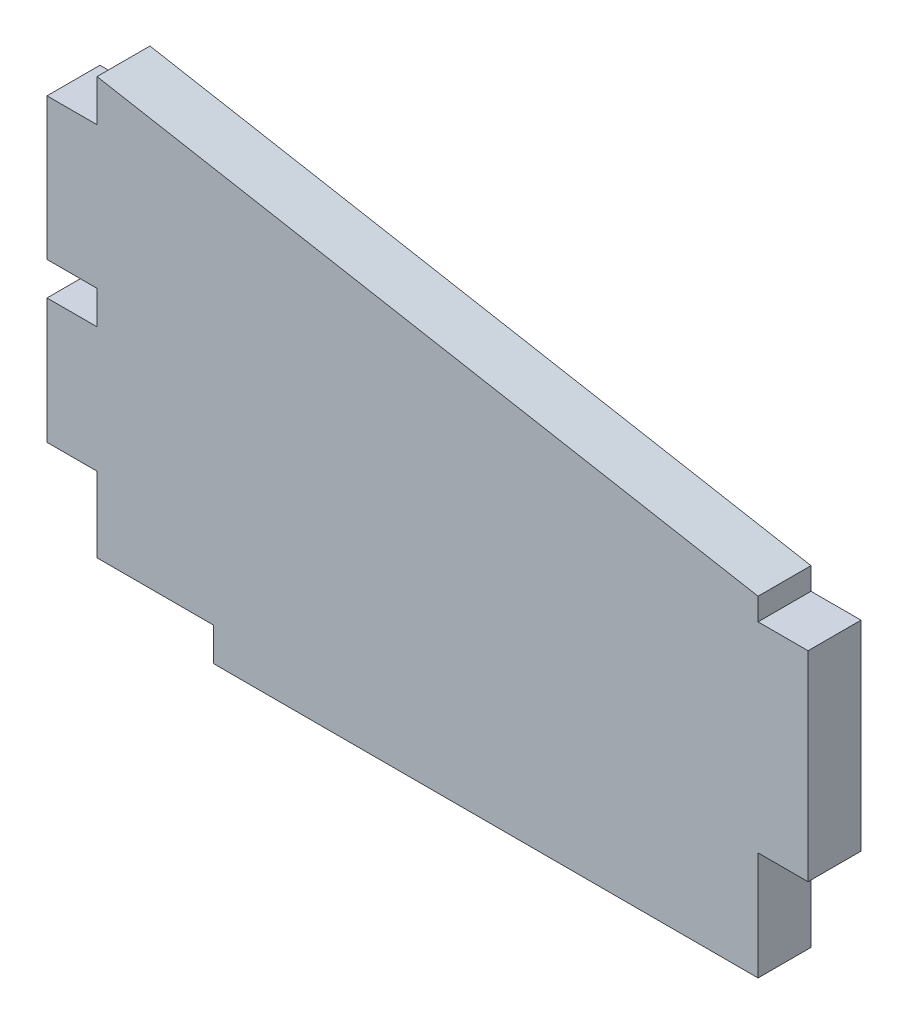
from build123d import *

# Parameters (mm, degrees)
SKETCH1_W               = 3
SKETCH1_H               = 12
SKETCH1_H_2             = 18
BOSS_EXTRUDE1_DEPTH     = 3.175
SKETCH2_W               = 32.65
SKETCH2_H               = 2
BOSS_EXTRUDE2_DEPTH     = 3.175
CUT_EXTRUDE1_DEPTH      = 28.227031605
CUT_EXTRUDE1_DEPTH_BACK = 28.227031605
SKETCH3_W               = 3
SKETCH3_H               = 2


with BuildPart() as part:
    # Sketch1 → Boss-Extrude1 (new body)
    with BuildSketch(Plane.XY):
        Polygon((19.825, 5.331730769), (-19.825, 12.5), (-19.825, 10), (-19.825, -8), (-19.825, -12.5), (19.825, -12.5), (19.825, -8), (19.825, 4), align=None)
        with Locations((21.325, -2)):
            Rectangle(SKETCH1_W, SKETCH1_H)
        with Locations((-21.325, 1)):
            Rectangle(SKETCH1_W, SKETCH1_H_2)
    extrude(amount=BOSS_EXTRUDE1_DEPTH)

    # Sketch2 → Boss-Extrude2 (add)
    with BuildSketch(Plane.XY.offset(3.175)):
        with Locations((3.5, -13.5)):
            Rectangle(SKETCH2_W, SKETCH2_H)
    extrude(amount=-BOSS_EXTRUDE2_DEPTH)

    # Sketch3 → Cut-Extrude1 (cut, two sides: drawn at the far end of the back side and taken through both)
    with BuildSketch(Plane.XY.offset(3.175).offset(-CUT_EXTRUDE1_DEPTH_BACK)):
        with Locations((-21.325, 0.5)):
            Rectangle(SKETCH3_W, SKETCH3_H)
    extrude(amount=CUT_EXTRUDE1_DEPTH + CUT_EXTRUDE1_DEPTH_BACK, mode=Mode.SUBTRACT)


solid = part.part
